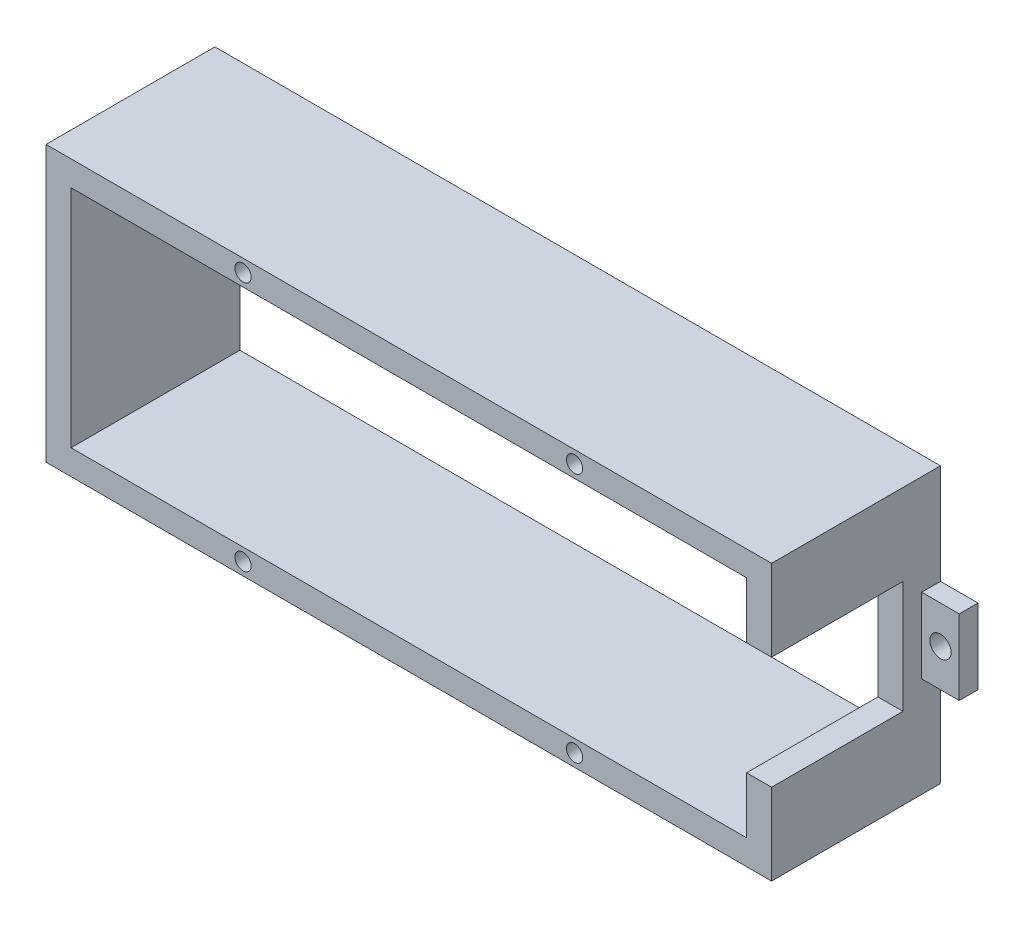
from build123d import *

# Parameters (mm, degrees)
SKETCH1_W        = 116
SKETCH1_H        = 44
SKETCH1_W_2      = 108
SKETCH1_H_2      = 36
WALLS_DEPTH      = 27
SKETCH2_W        = 6
SKETCH2_H        = 12
FLOOR_TABS_DEPTH = 3
SKETCH3_R        = 1.7
TAB_HOLES_DEPTH  = 5
SKETCH4_W        = 10
SKETCH4_H        = 4
BAR_BOSSES_DEPTH = 8
SKETCH5_R        = 1.3
BAR_PILOTS_DEPTH = 9
SKETCH6_W        = 22
SKETCH6_H        = 18
LEAD_EXIT_DEPTH  = 6


with BuildPart() as part:
    # Sketch1 → Walls (new body)
    with BuildSketch(Plane.XY.offset(60)):
        with Locations((0, 42)):
            Rectangle(SKETCH1_W, SKETCH1_H)
        with Locations((0, 42)):
            Rectangle(SKETCH1_W_2, SKETCH1_H_2, mode=Mode.SUBTRACT)
    extrude(amount=WALLS_DEPTH)

    # Sketch2 → Floor_tabs (add)
    with BuildSketch(Plane.XY.offset(60)):
        with Locations((61, 42)):
            Rectangle(SKETCH2_W, SKETCH2_H)
        with Locations((-61, 42)):
            Rectangle(SKETCH2_W, SKETCH2_H)
    extrude(amount=FLOOR_TABS_DEPTH)

    # Sketch3 → Tab_holes (cut)
    with BuildSketch(Plane.XY.offset(59)):
        with Locations((61, 42)):
            Circle(SKETCH3_R)
        with Locations((-61, 42)):
            Circle(SKETCH3_R)
    extrude(amount=TAB_HOLES_DEPTH, mode=Mode.SUBTRACT)

    # Sketch4 → Bar_bosses (add)
    with BuildSketch(Plane.XY.offset(79)):
        with Locations((26.5, 62)):
            Rectangle(SKETCH4_W, SKETCH4_H)
        with Locations((-26.5, 62)):
            Rectangle(SKETCH4_W, SKETCH4_H)
        with Locations((26.5, 22)):
            Rectangle(SKETCH4_W, SKETCH4_H)
        with Locations((-26.5, 22)):
            Rectangle(SKETCH4_W, SKETCH4_H)
    extrude(amount=BAR_BOSSES_DEPTH)

    # Sketch5 → Bar_pilots (cut)
    with BuildSketch(Plane.XY.offset(79)):
        with Locations((26.5, 62)):
            Circle(SKETCH5_R)
        with Locations((26.5, 22)):
            Circle(SKETCH5_R)
        with Locations((-26.5, 62)):
            Circle(SKETCH5_R)
        with Locations((-26.5, 22)):
            Circle(SKETCH5_R)
    extrude(amount=BAR_PILOTS_DEPTH, mode=Mode.SUBTRACT)

    # Sketch6 → Lead_exit (cut)
    with BuildSketch(Plane(origin=(53, 0, 0), x_dir=(0, 0, -1), z_dir=(1, 0, 0))):
        with Locations((-77, 42)):
            Rectangle(SKETCH6_W, SKETCH6_H)
    extrude(amount=LEAD_EXIT_DEPTH, mode=Mode.SUBTRACT)


solid = part.part
